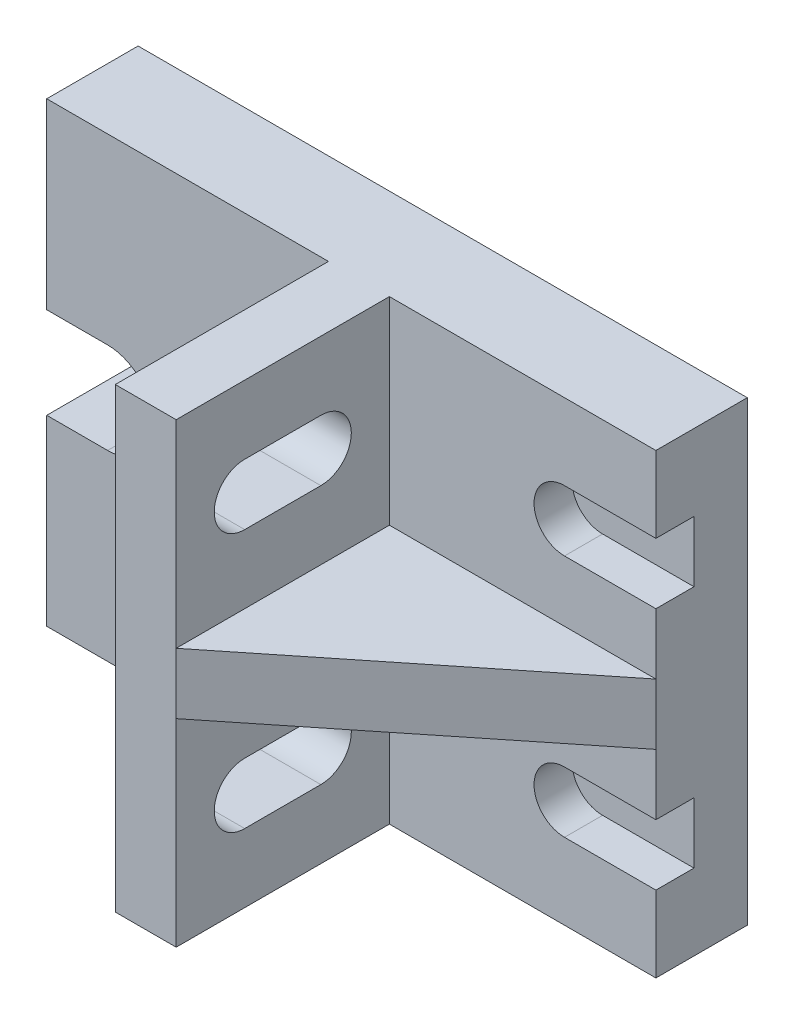
from build123d import *

# Parameters (mm, degrees)
SKETCH_1_W          = 200
SKETCH_1_H          = 150
EXTRUDE_1_DEPTH     = 30
CUT_EXTRUDE_7_DEPTH = 12.5
CUT_EXTRUDE_8_DEPTH = 252.79356624
SKETCH_6_W          = 20
SKETCH_6_H          = 150
EXTRUDE_2_DEPTH     = 70
EXTRUDE_START       = -85
EXTRUDE_4_DEPTH     = 20
CUT_EXTRUDE_9_DEPTH = 20


with BuildPart() as part:
    # Эскиз1 → Бобышка-Вытянуть1 (new body)
    with BuildSketch(Plane.XY):
        with Locations((100, -75)):
            Rectangle(SKETCH_1_W, SKETCH_1_H)
    extrude(amount=EXTRUDE_1_DEPTH)

    # Эскиз2 → Вырез-Вытянуть7 (cut)
    with BuildSketch(Plane.XY.offset(30)):
        with BuildLine():
            Line((200, -105), (170, -105))
            ThreePointArc((170, -105), (160, -115), (170, -125))
            Line((170, -125), (200, -125))
            Line((200, -125), (200, -105))
        make_face()
        with BuildLine():
            Line((200, -25), (170, -25))
            ThreePointArc((170, -25), (160, -35), (170, -45))
            Line((170, -45), (200, -45))
            Line((200, -45), (200, -25))
        make_face()
    extrude(amount=-CUT_EXTRUDE_7_DEPTH, mode=Mode.SUBTRACT)

    # Эскиз5 → Вырез-Вытянуть8 (cut, through all)
    with BuildSketch(Plane.XY.offset(30)):
        with BuildLine():
            Line((0, -60), (20, -60))
            ThreePointArc((20, -60), (35, -75), (20, -90))
            Line((20, -90), (0, -90))
            Line((0, -90), (0, -60))
        make_face()
    extrude(amount=-CUT_EXTRUDE_8_DEPTH, mode=Mode.SUBTRACT)

    # Эскиз6 → Бобышка-Вытянуть2 (add)
    with BuildSketch(Plane.XY.offset(30)):
        with Locations((102.5, -75)):
            Rectangle(SKETCH_6_W, SKETCH_6_H)
    extrude(amount=EXTRUDE_2_DEPTH)

    # Эскиз7 → Бобышка-Вытянуть4 (add)
    with BuildSketch(Plane.XZ.offset(150).offset(EXTRUDE_START)):
        Polygon((112.5, 100), (200, 30), (112.5, 30), align=None)
    extrude(amount=EXTRUDE_4_DEPTH)

    # Эскиз10 → Вырез-Вытянуть9 (cut)
    with BuildSketch(Plane(origin=(112.5, 0, 0), x_dir=(0, 0, -1), z_dir=(1, 0, 0))):
        with BuildLine():
            Line((-52.5, -127.5), (-77.5, -127.5))
            ThreePointArc((-77.5, -127.5), (-87.5, -117.5), (-77.5, -107.5))
            Line((-77.5, -107.5), (-52.5, -107.5))
            ThreePointArc((-52.5, -107.5), (-42.5, -117.5), (-52.5, -127.5))
        make_face()
        with BuildLine():
            Line((-52.5, -22.5), (-77.5, -22.5))
            ThreePointArc((-77.5, -22.5), (-87.5, -32.5), (-77.5, -42.5))
            Line((-77.5, -42.5), (-52.5, -42.5))
            ThreePointArc((-52.5, -42.5), (-42.5, -32.5), (-52.5, -22.5))
        make_face()
    extrude(amount=-CUT_EXTRUDE_9_DEPTH, mode=Mode.SUBTRACT)


solid = part.part
